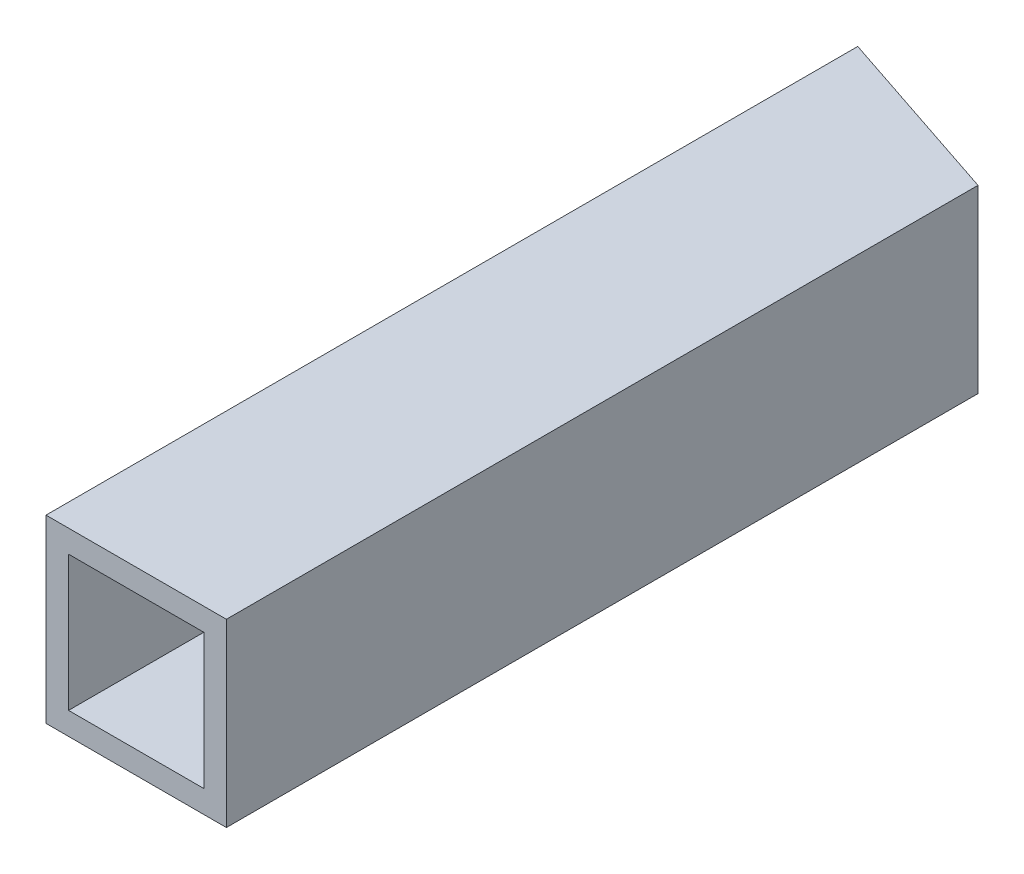
from build123d import *

# Parameters (mm, degrees)
SKETCH1_W           = 25.4
SKETCH1_H           = 25.4
SKETCH1_W_2         = 19.05
SKETCH1_H_2         = 19.05
BOSS_EXTRUDE1_DEPTH = 114.3
CUT_EXTRUDE1_DEPTH  = 120.811560377


with BuildPart() as part:
    # Sketch1 → Boss-Extrude1 (new body)
    with BuildSketch(Plane.XY):
        with Locations((12.7, 12.7)):
            Rectangle(SKETCH1_W, SKETCH1_H)
        with Locations((12.7, 12.7)):
            Rectangle(SKETCH1_W_2, SKETCH1_H_2, mode=Mode.SUBTRACT)
    extrude(amount=BOSS_EXTRUDE1_DEPTH)

    # Sketch2 → Cut-Extrude1 (cut, through all)
    with BuildSketch(Plane(origin=(0, 25.4, 0), x_dir=(1, 0, 0), z_dir=(0, 1, 0))):
        Polygon((0, 0), (25.4, -8.469154802), (25.4, 0), align=None)
    extrude(amount=-CUT_EXTRUDE1_DEPTH, mode=Mode.SUBTRACT)


solid = part.part
